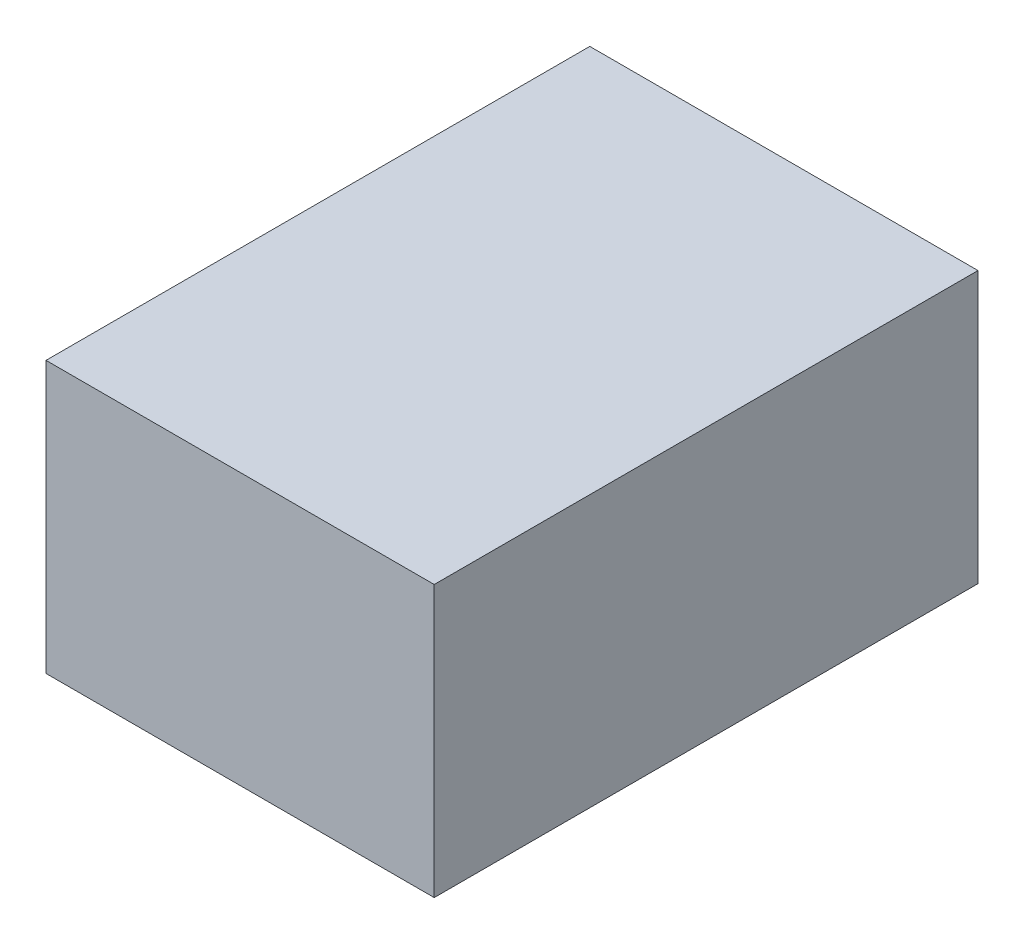
from build123d import *

# Parameters (mm, degrees)
ESQUISSE1_W        = 27.2
ESQUISSE1_H        = 38.1
BOSS_EXTRU_1_DEPTH = 19


with BuildPart() as part:
    # Esquisse1 → Boss.-Extru.1 (new body)
    with BuildSketch(Plane(origin=(0, 0, 0), x_dir=(1, 0, 0), z_dir=(0, 1, 0))):
        with Locations((13.6, 19.05)):
            Rectangle(ESQUISSE1_W, ESQUISSE1_H)
    extrude(amount=BOSS_EXTRU_1_DEPTH)


solid = part.part
